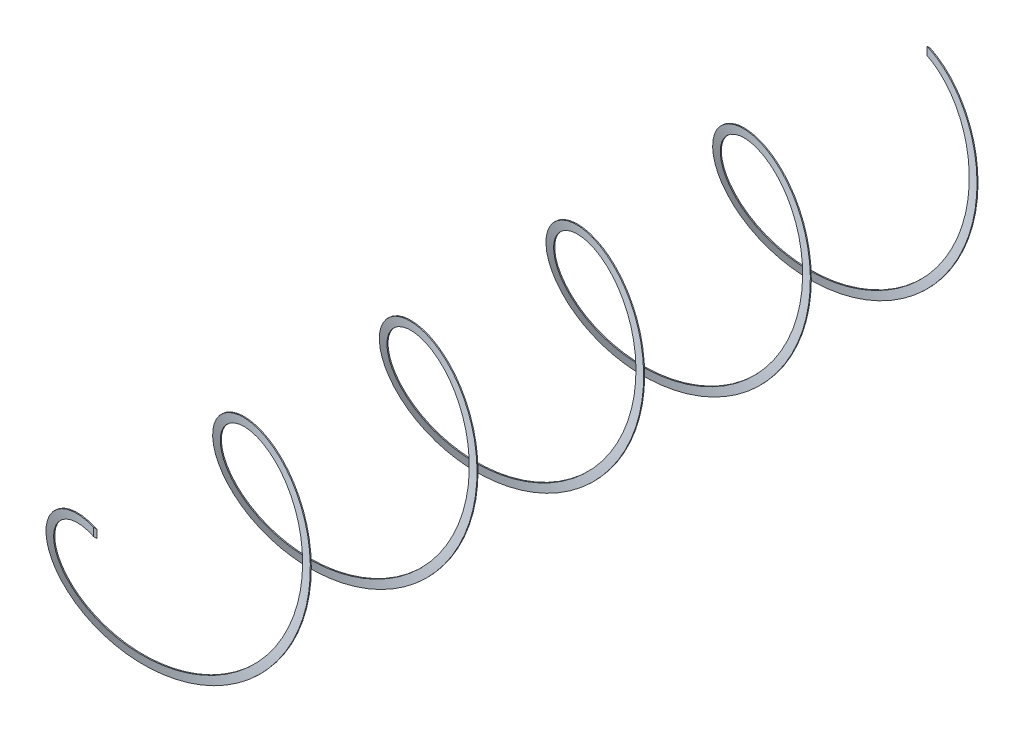
from build123d import *

# Parameters (mm, degrees)
SWEEP1_PITCH       = 514
SWEEP1_HEIGHT      = 2570
SWEEP1_RADIUS      = 254
SWEEP1_START_ANGLE = 135
SKETCH2_W          = 10
SKETCH2_H          = 25


with BuildPart() as part:
    # Sweep1: sweep along a helix
    with BuildLine() as sweep1_path:
        add(Helix(SWEEP1_PITCH, SWEEP1_HEIGHT, SWEEP1_RADIUS, center=(0, 0, 0), direction=(0, 0, 1), lefthand=True, mode=Mode.PRIVATE).rotate(Axis((0, 0, 0), (0, 0, 1)), SWEEP1_START_ANGLE))
    # Sketch2 → Sweep1 (sweep)
    with BuildSketch(Plane.XY):
        with Locations((0, 254)):
            Rectangle(SKETCH2_W, SKETCH2_H)
    sweep(path=sweep1_path.line, is_frenet=True)


solid = part.part
